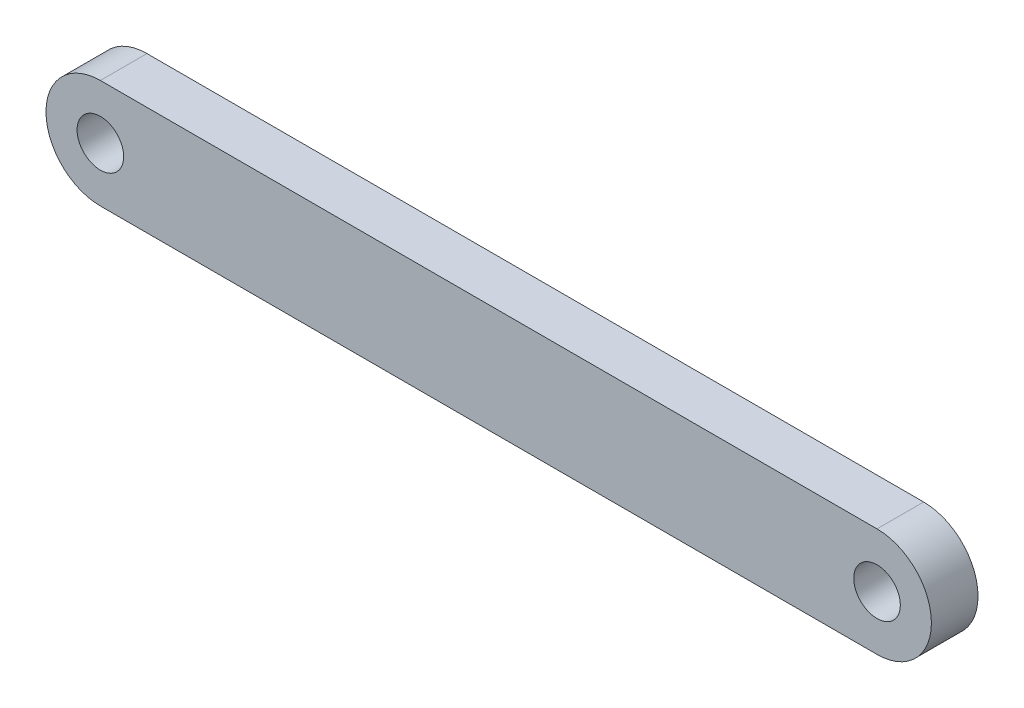
from build123d import *

# Parameters (mm, degrees)
SKETCH1_R           = 1.5
BOSS_EXTRUDE1_DEPTH = 3


with BuildPart() as part:
    # Sketch1 → Boss-Extrude1 (new body)
    with BuildSketch(Plane.XY):
        with BuildLine():
            Line((50.75, 28.5), (0.75, 28.5))
            ThreePointArc((0.75, 28.5), (-2.75, 32), (0.75, 35.5))
            Line((0.75, 35.5), (50.75, 35.5))
            ThreePointArc((50.75, 35.5), (54.25, 32), (50.75, 28.5))
        make_face()
        with Locations((50.75, 32)):
            Circle(SKETCH1_R, mode=Mode.SUBTRACT)
        with Locations((0.75, 32)):
            Circle(SKETCH1_R, mode=Mode.SUBTRACT)
    extrude(amount=BOSS_EXTRUDE1_DEPTH)


solid = part.part
